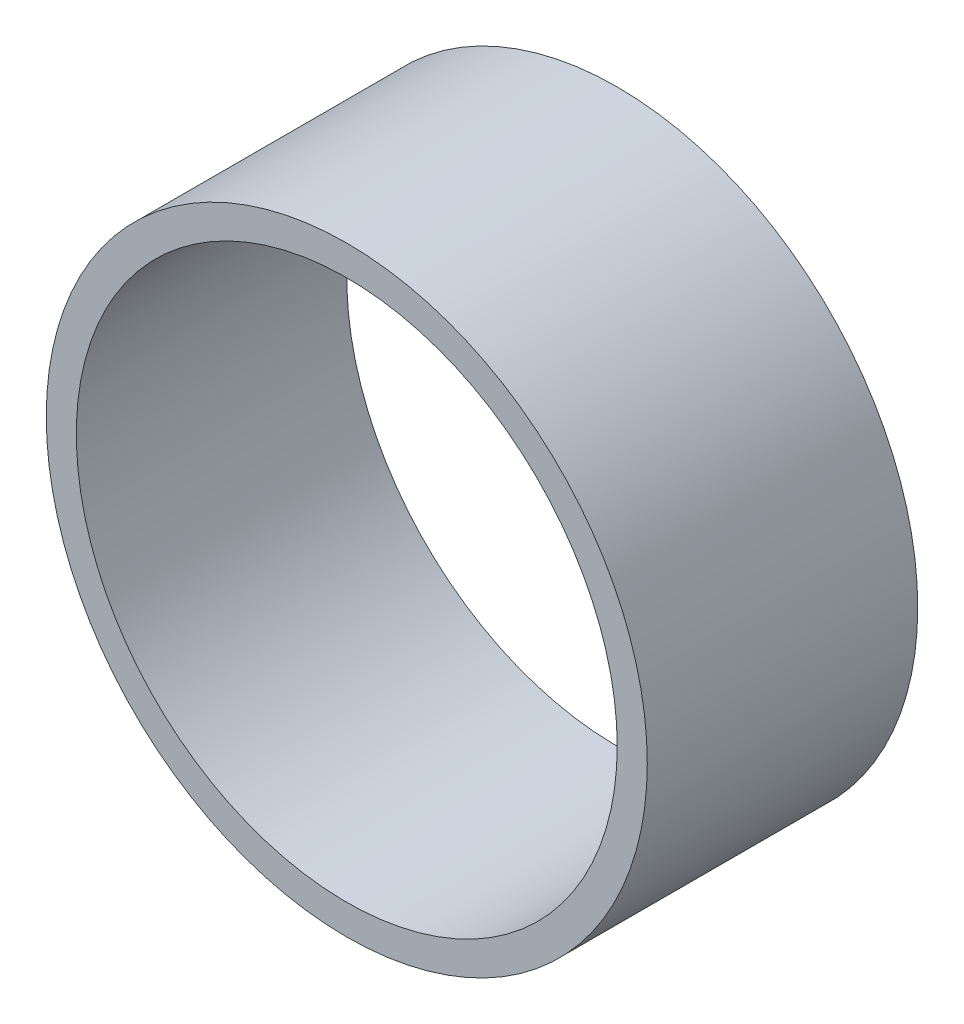
from build123d import *

# Parameters (mm, degrees)
SKETCH_1_R      = 10
EXTRUDE_1_DEPTH = 9
SCALE_2_SCALE   = 1.2
SHELL_3_T       = -1.2


with BuildPart() as part:
    # 草图1 → 凸台-拉伸1 (new body)
    with BuildSketch(Plane.XY):
        Circle(SKETCH_1_R)
    extrude(amount=EXTRUDE_1_DEPTH)


with BuildPart() as part_1:
    # 缩放比例2: scaled about (0, 0, 0)
    add(part.part.scale(SCALE_2_SCALE))

    # 抽壳3
    shell_3_openings = [part_1.faces().sort_by_distance(p)[0] for p in [
        (0, 0, 10.8),
        (0, 0, 0),
    ]]
    offset(amount=SHELL_3_T, openings=shell_3_openings, kind=Kind.INTERSECTION)


solid = part_1.part
